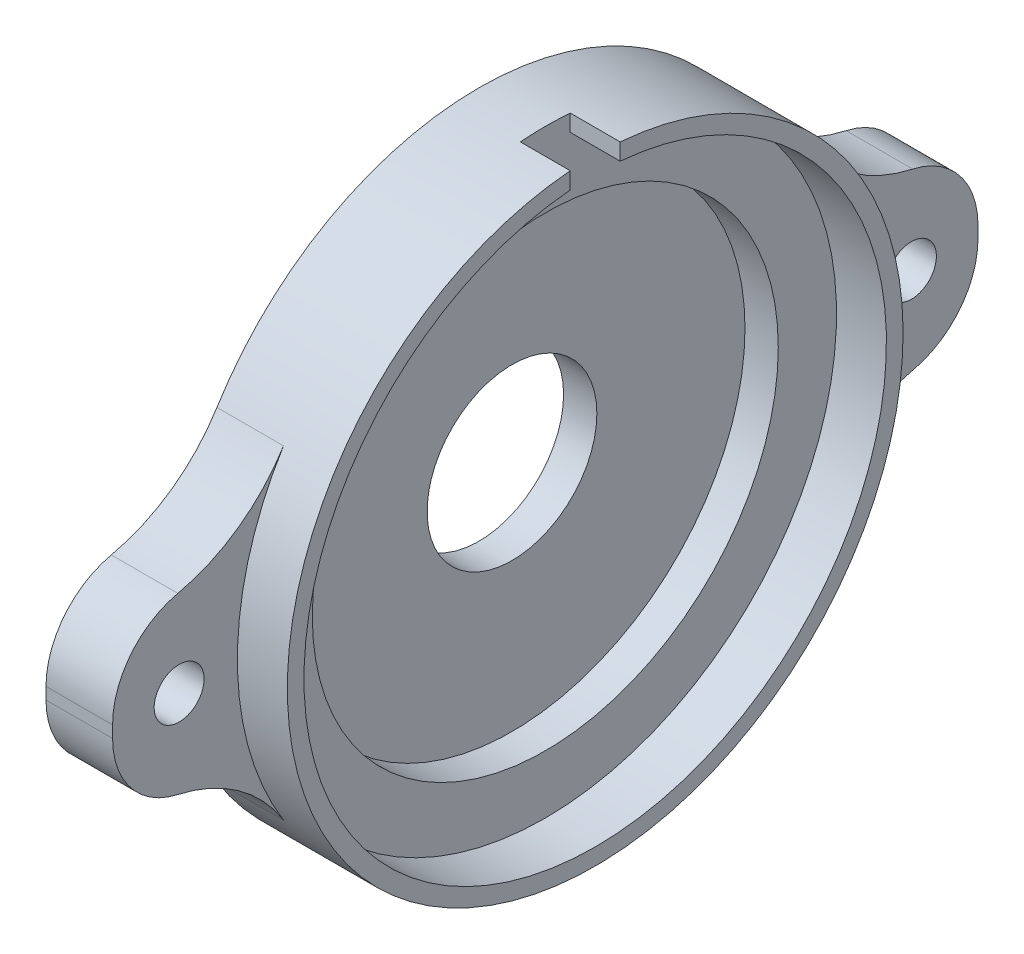
from build123d import *

# Parameters (mm, degrees)
SKETCH_1_R          = 18.5
EXTRUDE_1_DEPTH     = 7
EXTRUDE_2_DEPTH     = 4
SKETCH_2_R          = 17.5
CUT_EXTRUDE_1_DEPTH = 3
SKETCH_3_R          = 14
CUT_EXTRUDE_2_DEPTH = 2
CUT_EXTRUDE_5_REACH = 34.299
SKETCH_8_R          = 5.1
CUT_EXTRUDE_6_REACH = 34.16
SKETCH_11_R         = 1.5
FILLET_1_R          = 10
FILLET_2_R          = 5
SKETCH_12_W         = 3
SKETCH_12_H         = 2.288293169
CUT_EXTRUDE_7_DEPTH = 3


with BuildPart() as part:
    # 草图1 → 凸台-拉伸1 (new body)
    with BuildSketch(Plane(origin=(0, 0, 0), x_dir=(0, 0, -1), z_dir=(1, 0, 0))):
        Circle(SKETCH_1_R)
    extrude(amount=EXTRUDE_1_DEPTH)

    # 草图10 → 凸台-拉伸2 (add)
    with BuildSketch(Plane.ZY):
        Polygon((0, 5), (26, 5), (26, -5), (0, -5), (-26, -5), (-26, 5), align=None)
    extrude(amount=-EXTRUDE_2_DEPTH)

    # 草图2 → 切除-拉伸1 (cut)
    with BuildSketch(Plane(origin=(7, 0, 0), x_dir=(0, 0, -1), z_dir=(1, 0, 0))):
        Circle(SKETCH_2_R)
    extrude(amount=-CUT_EXTRUDE_1_DEPTH, mode=Mode.SUBTRACT)

    # 草图3 → 切除-拉伸2 (cut)
    with BuildSketch(Plane(origin=(4, 0, 0), x_dir=(0, 0, -1), z_dir=(1, 0, 0))):
        Circle(SKETCH_3_R)
    extrude(amount=-CUT_EXTRUDE_2_DEPTH, mode=Mode.SUBTRACT)

    # 草图8 → 切除-拉伸5 (cut, up to next)
    with BuildSketch(Plane(origin=(2, 0, 0), x_dir=(0, 0, -1), z_dir=(1, 0, 0)), mode=Mode.PRIVATE) as cut_extrude_5_sk1:
        Circle(SKETCH_8_R)
    cut_extrude_5_tool1 = extrude(cut_extrude_5_sk1.sketch, amount=-CUT_EXTRUDE_5_REACH, mode=Mode.PRIVATE) & part.part
    add(cut_extrude_5_tool1.solids().sort_by_distance((2, 0, 0))[0], mode=Mode.SUBTRACT)

    # 草图11 → 切除-拉伸6 (cut, up to next)
    with BuildSketch(Plane(origin=(4, 0, 0), x_dir=(0, 0, -1), z_dir=(1, 0, 0)), mode=Mode.PRIVATE) as cut_extrude_6_sk1:
        with Locations((-22, 0)):
            Circle(SKETCH_11_R)
    cut_extrude_6_tool1 = extrude(cut_extrude_6_sk1.sketch, amount=-CUT_EXTRUDE_6_REACH, mode=Mode.PRIVATE) & part.part
    # 草图11 → 切除-拉伸6 (cut, up to next)
    with BuildSketch(Plane(origin=(4, 0, 0), x_dir=(0, 0, -1), z_dir=(1, 0, 0)), mode=Mode.PRIVATE) as cut_extrude_6_sk2:
        with Locations((22, 0)):
            Circle(SKETCH_11_R)
    cut_extrude_6_tool2 = extrude(cut_extrude_6_sk2.sketch, amount=-CUT_EXTRUDE_6_REACH, mode=Mode.PRIVATE) & part.part
    add(cut_extrude_6_tool1.solids().sort_by_distance((4, 0, 22))[0], mode=Mode.SUBTRACT)
    add(cut_extrude_6_tool2.solids().sort_by_distance((4, 0, -22))[0], mode=Mode.SUBTRACT)

    # 圆角1
    fillet_1_edges = [part.edges().sort_by_distance(p)[0] for p in [
        (2, 5, -17.811513131),
        (2, 5, 17.811513131),
        (2, -5, 17.811513131),
        (2, -5, -17.811513131),
    ]]
    fillet(fillet_1_edges, radius=FILLET_1_R)

    # 圆角2
    fillet_2_edges = [part.edges().sort_by_distance(p)[0] for p in [
        (2, 5, 26),
        (2, -5, 26),
        (2, -5, -26),
        (2, 5, -26),
    ]]
    fillet(fillet_2_edges, radius=FILLET_2_R)

    # 草图12 → 切除-拉伸7 (cut)
    with BuildSketch(Plane(origin=(7, 0, 0), x_dir=(0, 0, -1), z_dir=(1, 0, 0))):
        with Locations((0, 18.044159171)):
            Rectangle(SKETCH_12_W, SKETCH_12_H)
    extrude(amount=-CUT_EXTRUDE_7_DEPTH, mode=Mode.SUBTRACT)


solid = part.part
